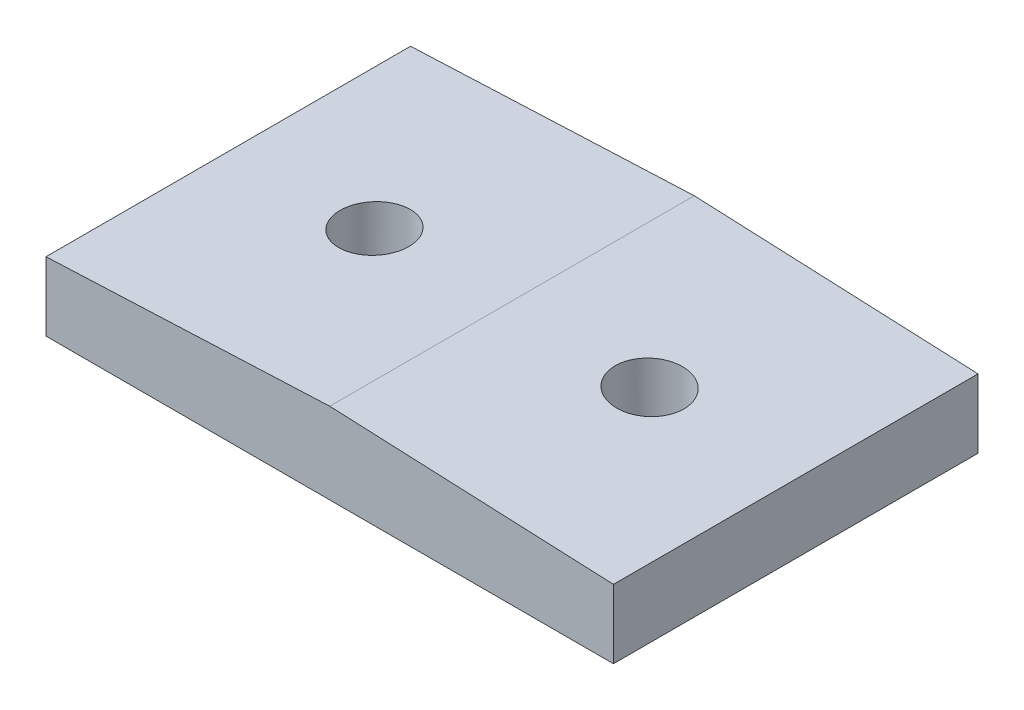
from build123d import *

# Parameters (mm, degrees)
EXTRUDE_1_DEPTH     = 10.6
SKETCH_2_R          = 1
CUT_EXTRUDE_1_DEPTH = 14.637927158


with BuildPart() as part:
    # 草图1 → 凸台-拉伸1 (new body)
    with BuildSketch(Plane.XY):
        Polygon((-8.25, 0), (8.25, 0), (8.25, 2), (0, 2.360202779), (-8.25, 2), align=None)
    extrude(amount=EXTRUDE_1_DEPTH)

    # 草图2 → 切除-拉伸1 (cut, through all)
    with BuildSketch(Plane.XZ):
        with Locations((4, 5.3)):
            Circle(SKETCH_2_R)
        with Locations(Location((-4, 5.3, 0), (0, 0, 180))):
            Circle(SKETCH_2_R)
    extrude(amount=-CUT_EXTRUDE_1_DEPTH, mode=Mode.SUBTRACT)


solid = part.part
